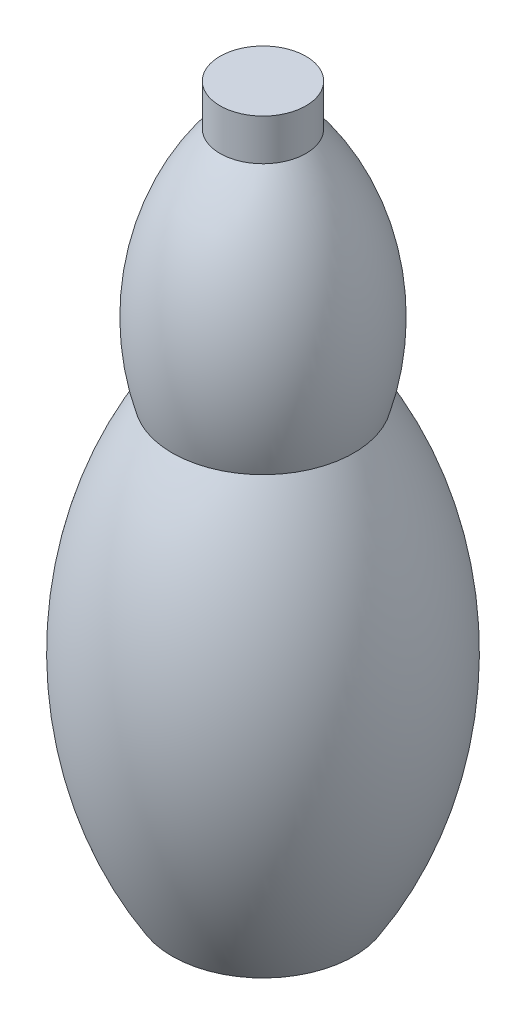
from build123d import *


with BuildPart() as part:
    # Croquis1 → Revolución1 (revolve)
    with BuildSketch(Plane.XY, mode=Mode.PRIVATE) as revoluci_n1_sk:
        with BuildLine():
            Line((0, 0), (0, 150))
            Line((0, 150), (9.042114597, 150))
            Line((9.042114597, 150), (9.042114597, 141.30528364))
            ThreePointArc((9.042114597, 141.30528364), (20.224074745, 117.779180268), (19.123963026, 91.754124517))
            ThreePointArc((19.123963026, 91.754124517), (32.208336123, 45.877062258), (19.123963026, 0))
            Line((19.123963026, 0), (0, 0))
        make_face()
    revolve(revoluci_n1_sk.sketch.rotate(Axis((0, 0, 0), (0, 1, 0)), 90), axis=Axis((0, 0, 0), (0, 1, 0)))


solid = part.part
